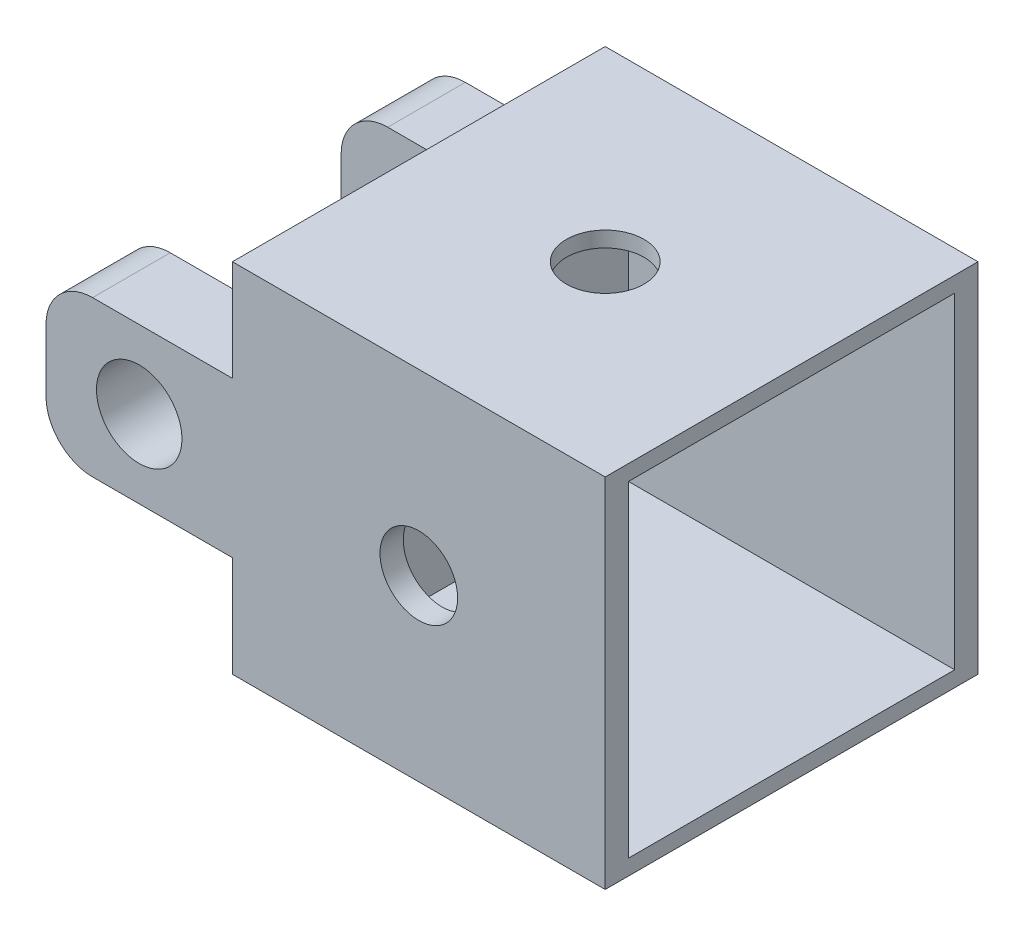
from build123d import *

# Parameters (mm, degrees)
SKETCH1_W            = 24
SKETCH1_H            = 24
BOSS_EXTRUDE1_DEPTH  = 11.5
SKETCH2_W            = 21
SKETCH2_H            = 21
CUT_EXTRUDE1_DEPTH   = 21
SKETCH3_R            = 2.5
CUT_EXTRUDE2_DEPTH   = 3
SKETCH4_R            = 2.5
CUT_EXTRUDE3_DEPTH   = 3
BOSS_EXTRUDE3_DEPTH  = 12
SKETCH9_R            = 2.75
CUT_EXTRUDE5_DEPTH   = 5
FILLET2_R            = 3
FILLET2_OF_MIRROR1_R = 3


with BuildPart() as part:
    # Sketch1 → Boss-Extrude1 (new, symmetric)
    with BuildSketch(Plane(origin=(0, 0, 0), x_dir=(1, 0, 0), z_dir=(0, 1, 0))):
        Rectangle(SKETCH1_W, SKETCH1_H)
    extrude(amount=BOSS_EXTRUDE1_DEPTH, both=True)

    # Sketch2 → Cut-Extrude1 (cut)
    with BuildSketch(Plane(origin=(12, 0, 0), x_dir=(0, 0, -1), z_dir=(1, 0, 0))):
        Rectangle(SKETCH2_W, SKETCH2_H)
    extrude(amount=-CUT_EXTRUDE1_DEPTH, mode=Mode.SUBTRACT)

    # Sketch3 → Cut-Extrude2 (cut)
    with BuildSketch(Plane(origin=(0, 11.5, 0), x_dir=(1, 0, 0), z_dir=(0, 1, 0))):
        with Locations(Location((0, 0, 0), (0, 0, 270))):
            Circle(SKETCH3_R)
    extrude(amount=-CUT_EXTRUDE2_DEPTH, mode=Mode.SUBTRACT)

    # Sketch4 → Cut-Extrude3 (cut)
    with BuildSketch(Plane.XY.offset(12)):
        Circle(SKETCH4_R)
    extrude(amount=-CUT_EXTRUDE3_DEPTH, mode=Mode.SUBTRACT)

    # Sketch8 → Boss-Extrude3 (add)
    with BuildSketch(Plane.ZY.offset(12)):
        Polygon((-7, 0), (-7, 5), (-12, 5), (-12, 0), (-12, -5), (-7, -5), align=None)
    boss_extrude3 = extrude(amount=BOSS_EXTRUDE3_DEPTH)

    # Sketch9 → Cut-Extrude5 (cut)
    with BuildSketch(Plane(origin=(0, 0, -12), x_dir=(-1, 0, 0), z_dir=(0, 0, -1))):
        with Locations((18, 0)):
            Circle(SKETCH9_R)
    cut_extrude5 = extrude(amount=-CUT_EXTRUDE5_DEPTH, mode=Mode.SUBTRACT)

    # Fillet2
    fillet2_edges = [part.edges().sort_by_distance(p)[0] for p in [
        (-24, 5, -9.5),
        (-24, -5, -9.5),
    ]]
    fillet(fillet2_edges, radius=FILLET2_R)

    # Mirror1: Boss-Extrude3, Cut-Extrude5 across plane
    add(boss_extrude3.mirror(Plane.XY))
    add(cut_extrude5.mirror(Plane.XY), mode=Mode.SUBTRACT)

    # Fillet2 of Mirror1
    fillet2_of_mirror1_edges = [part.edges().sort_by_distance(p)[0] for p in [
        (-24, 5, 9.5),
        (-24, -5, 9.5),
    ]]
    fillet(fillet2_of_mirror1_edges, radius=FILLET2_OF_MIRROR1_R)


solid = part.part
